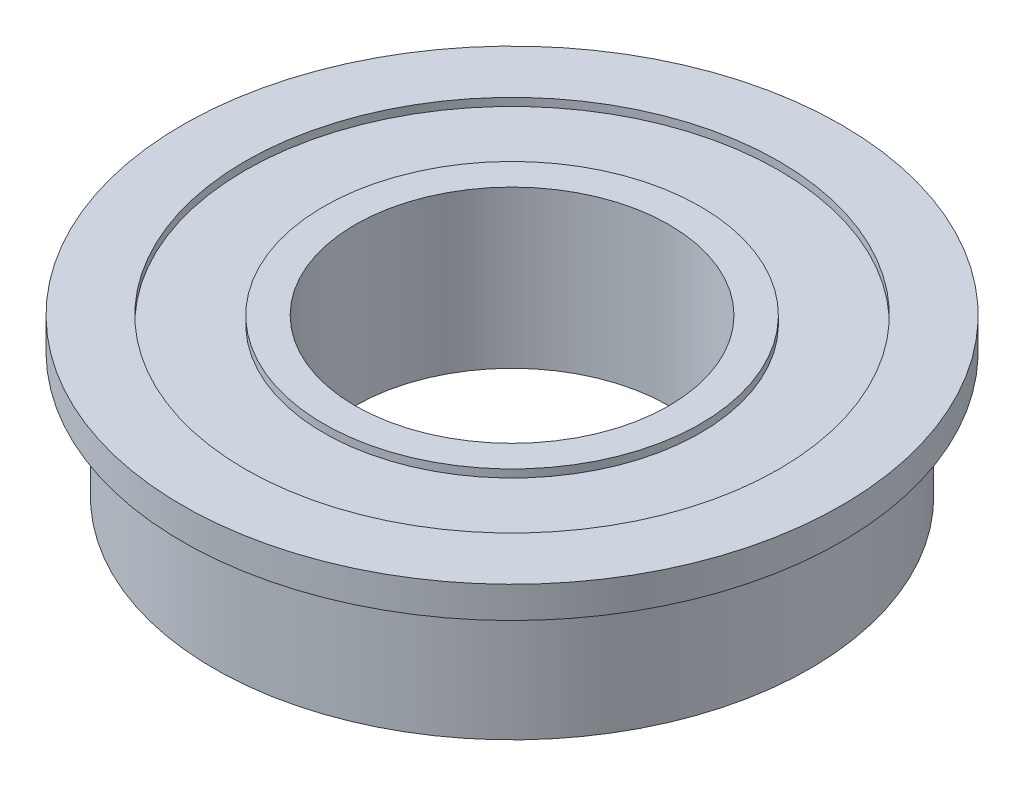
from build123d import *


with BuildPart() as part:
    # 草图2 → 旋转1 (revolve)
    with BuildSketch(Plane.XY, mode=Mode.PRIVATE) as revolve_1_sk:
        Polygon((5, 2.5), (5, -2.5), (6, -2.5), (6, -2.25), (8.5, -2.25), (8.5, -2.5), (9.5, -2.5), (9.5, 1.5), (10.5, 1.5), (10.5, 2.5), (9.5, 2.5), (8.5, 2.5), (8.5, 2.25), (6, 2.25), (6, 2.5), align=None)
    revolve(revolve_1_sk.sketch.rotate(Axis((0, 0, 0), (0, 1, 0)), 90), axis=Axis((0, 0, 0), (0, 1, 0)))


solid = part.part
